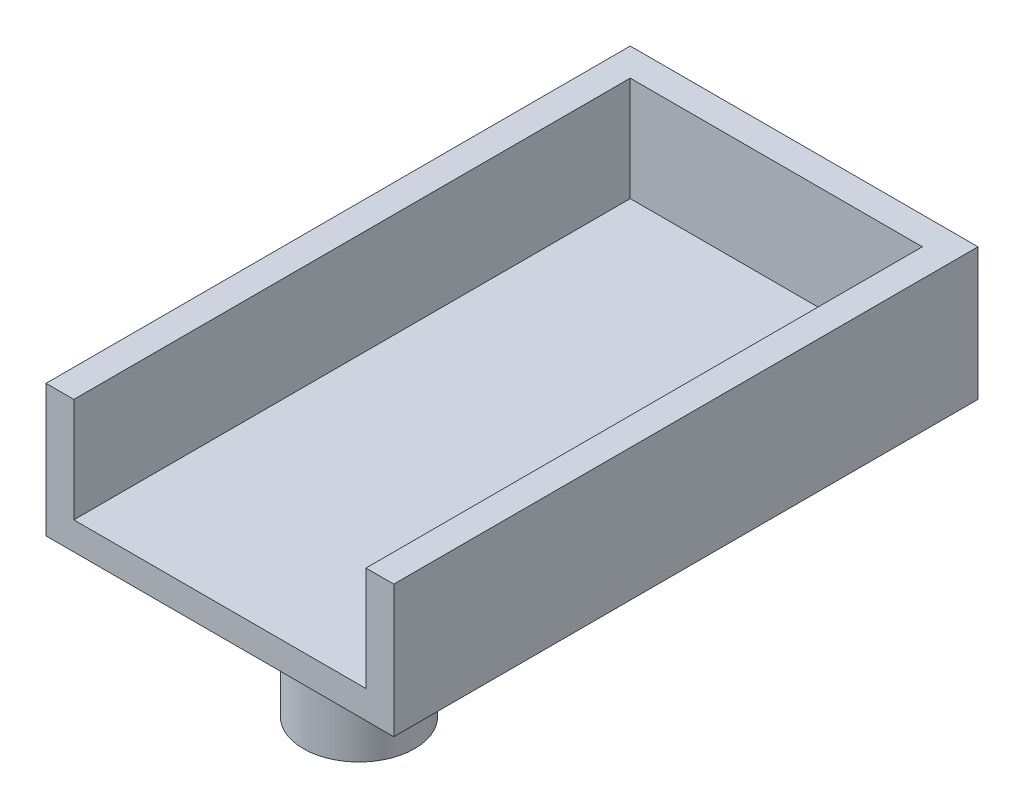
from build123d import *

# Parameters (mm, degrees)
SKETCH1_W           = 25
SKETCH1_H           = 40
BOSS_EXTRUDE1_DEPTH = 2
SKETCH2_W           = 2
SKETCH2_H           = 40
BOSS_EXTRUDE2_DEPTH = 7.5
SKETCH3_R           = 4
BOSS_EXTRUDE3_DEPTH = 10
SKETCH4_W           = 25
SKETCH4_H           = 9.5
BOSS_EXTRUDE4_DEPTH = 2


with BuildPart() as part:
    # Sketch1 → Boss-Extrude1 (new body)
    with BuildSketch(Plane(origin=(0, 0, 0), x_dir=(1, 0, 0), z_dir=(0, 1, 0))):
        with Locations((12.5, 20)):
            Rectangle(SKETCH1_W, SKETCH1_H)
    extrude(amount=BOSS_EXTRUDE1_DEPTH)

    # Sketch2 → Boss-Extrude2 (add)
    with BuildSketch(Plane(origin=(0, 2, 0), x_dir=(1, 0, 0), z_dir=(0, 1, 0))):
        with Locations((1, 20)):
            Rectangle(SKETCH2_W, SKETCH2_H)
        with Locations((24, 20)):
            Rectangle(SKETCH2_W, SKETCH2_H)
    extrude(amount=BOSS_EXTRUDE2_DEPTH)

    # Sketch3 → Boss-Extrude3 (add)
    with BuildSketch(Plane(origin=(0, 0, 0), x_dir=(-1, 0, 0), z_dir=(0, -1, 0))):
        with Locations(Location((-12.5, 10, 0), (0, 0, 270))):
            Circle(SKETCH3_R)
    extrude(amount=BOSS_EXTRUDE3_DEPTH)

    # Sketch4 → Boss-Extrude4 (add)
    with BuildSketch(Plane(origin=(0, 0, -40), x_dir=(-1, 0, 0), z_dir=(0, 0, -1))):
        with Locations((-12.5, 4.75)):
            Rectangle(SKETCH4_W, SKETCH4_H)
    extrude(amount=BOSS_EXTRUDE4_DEPTH)


solid = part.part
